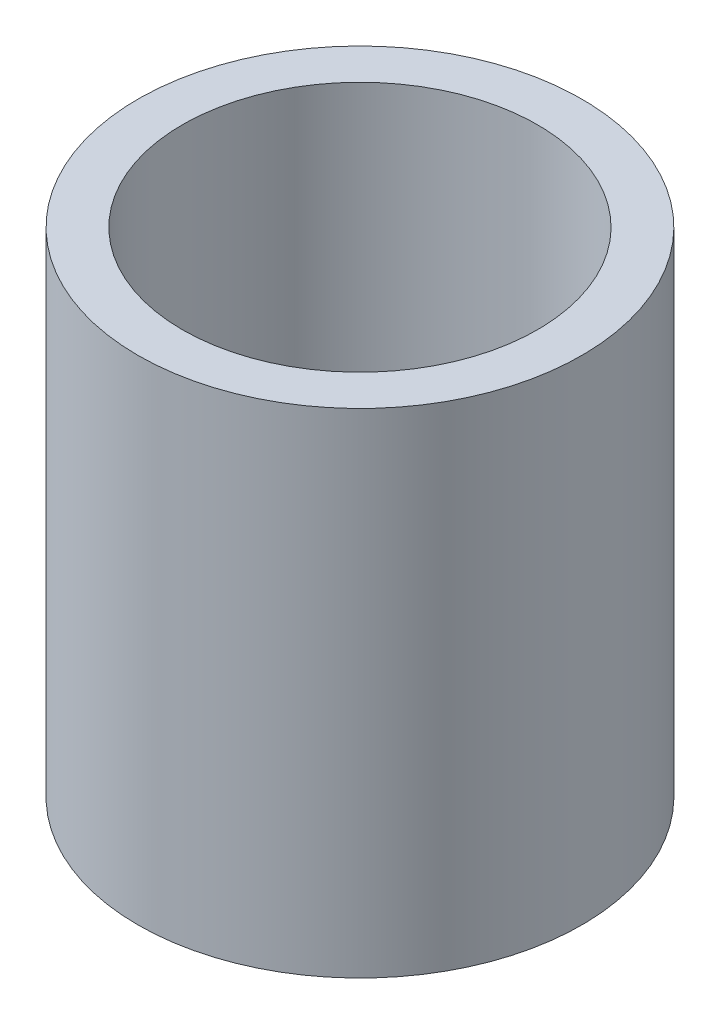
from build123d import *

# Parameters (mm, degrees)
SKETCH_1_R      = 2.25
SKETCH_1_R_2    = 1.8
EXTRUDE_1_DEPTH = 5


with BuildPart() as part:
    # 草图1 → 凸台-拉伸1 (new body)
    with BuildSketch(Plane(origin=(0, 0, 0), x_dir=(1, 0, 0), z_dir=(0, 1, 0))):
        with Locations(Location((0, 0, 0), (0, 0, 270))):
            Circle(SKETCH_1_R)
        with Locations(Location((0, 0, 0), (0, 0, 270))):
            Circle(SKETCH_1_R_2, mode=Mode.SUBTRACT)
    extrude(amount=EXTRUDE_1_DEPTH)


solid = part.part
